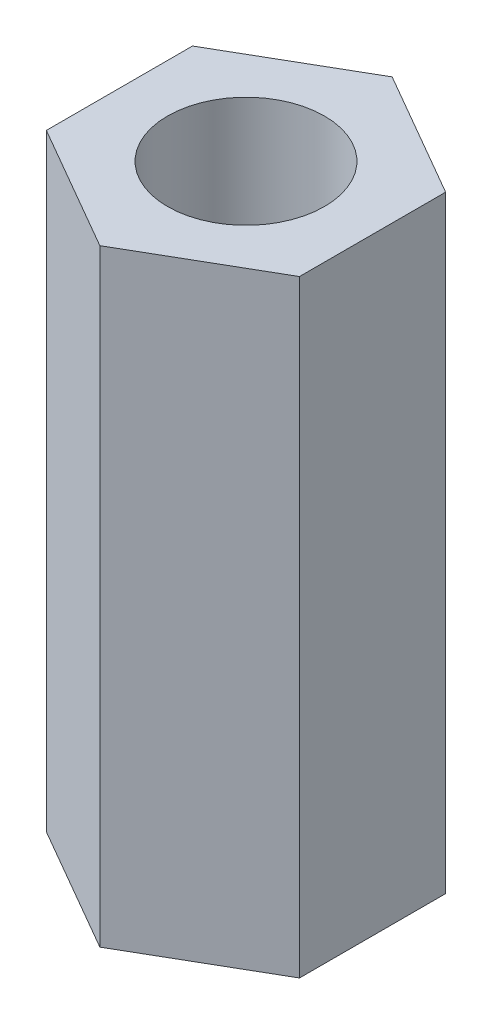
from build123d import *

# Parameters (mm, degrees)
SKETCH1_R           = 1.55
BOSS_EXTRUDE1_DEPTH = 12


with BuildPart() as part:
    # Sketch1 → Boss-Extrude1 (new body)
    with BuildSketch(Plane(origin=(0, 0, 0), x_dir=(1, 0, 0), z_dir=(0, 1, 0))):
        Polygon((0, 2.887), (2.500215341, 1.4435), (2.500215341, -1.4435), (0, -2.887), (-2.500215341, -1.4435), (-2.500215341, 1.4435), align=None)
        with Locations(Location((0, 0, 0), (0, 0, 270))):
            Circle(SKETCH1_R, mode=Mode.SUBTRACT)
    extrude(amount=BOSS_EXTRUDE1_DEPTH)


solid = part.part
